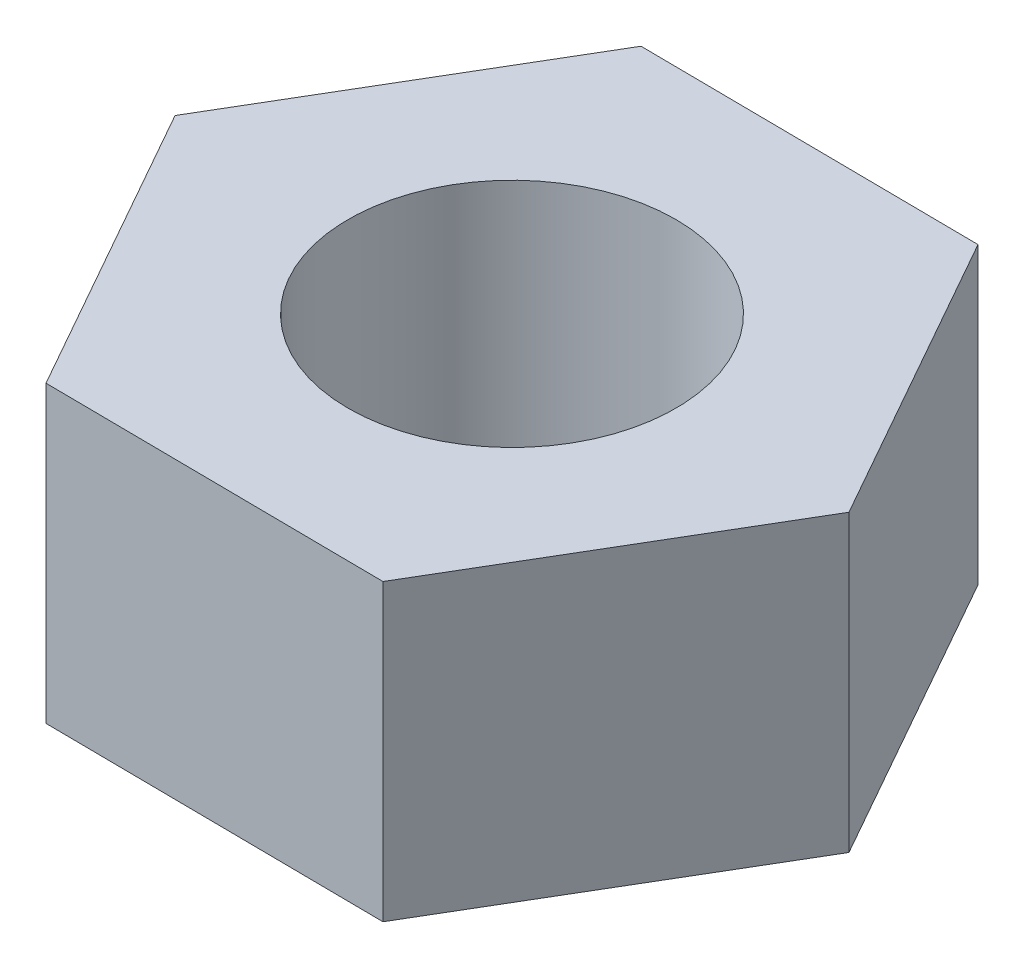
from build123d import *

# Parameters (mm, degrees)
SKETCH1_R           = 2.5
BOSS_EXTRUDE1_DEPTH = 4.5


with BuildPart() as part:
    # Sketch1 → Boss-Extrude1 (new body)
    with BuildSketch(Plane(origin=(0, 0, 0), x_dir=(1, 0, 0), z_dir=(0, 1, 0))):
        Polygon((2.641618547, 4.474578355), (-2.554289253, 4.524997946), (-5.1959078, 0.050419591), (-2.641618547, -4.474578355), (2.554289253, -4.524997946), (5.1959078, -0.050419591), align=None)
        with Locations(Location((0, 0, 0), (0, 0, 270))):
            Circle(SKETCH1_R, mode=Mode.SUBTRACT)
    extrude(amount=BOSS_EXTRUDE1_DEPTH)


solid = part.part
